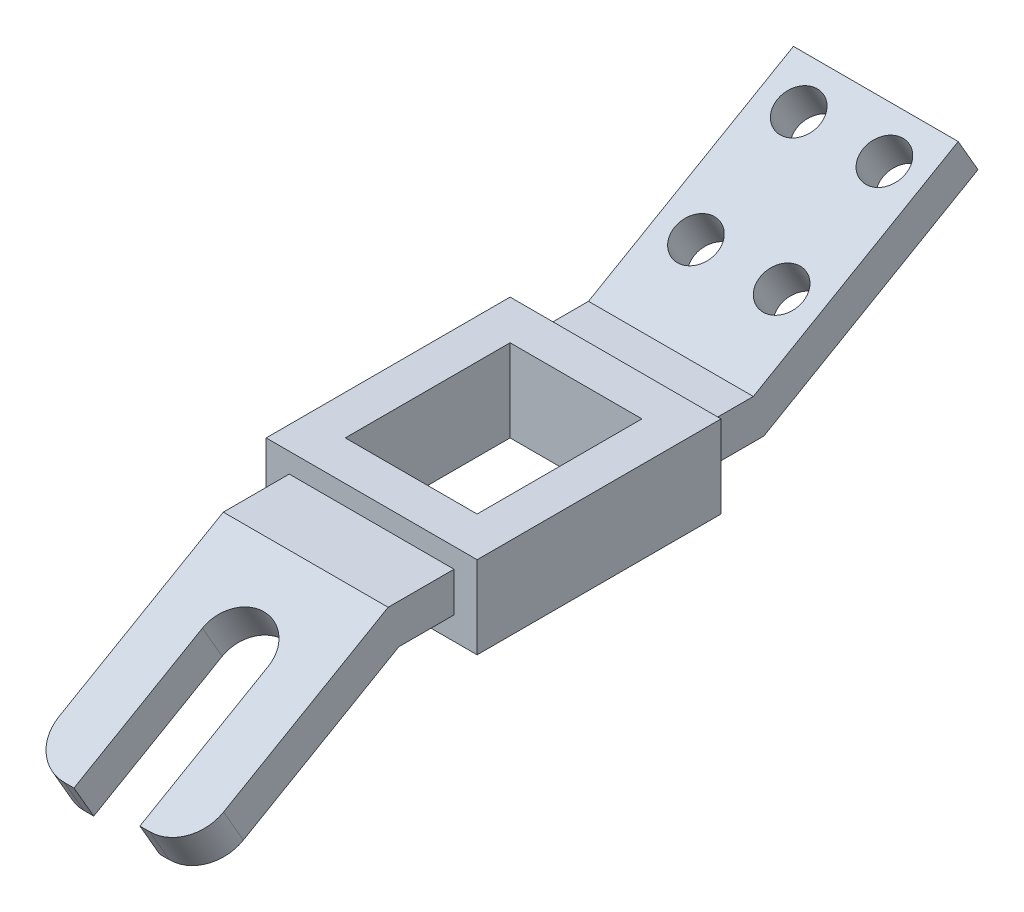
from build123d import *

# Parameters (mm, degrees)
CROQUIS1_W              = 64
CROQUIS1_H              = 74
CROQUIS1_W_2            = 40
CROQUIS1_H_2            = 50
SALIENTE_EXTRUIR2_DEPTH = 25
SALIENTE_EXTRUIR3_DEPTH = 25
CORTAR_EXTRUIR1_REACH   = 143.863
CROQUIS3_R              = 6.5
REDONDEO1_R             = 12
REDONDEO2_R             = 12
CORTAR_EXTRUIR2_REACH   = 163.641


with BuildPart() as part:
    # Croquis1 → Saliente-Extruir2 (new body)
    with BuildSketch(Plane(origin=(0, 0, 0), x_dir=(1, 0, 0), z_dir=(0, 1, 0))):
        Rectangle(CROQUIS1_W, CROQUIS1_H)
        Rectangle(CROQUIS1_W_2, CROQUIS1_H_2, mode=Mode.SUBTRACT)
    extrude(amount=SALIENTE_EXTRUIR2_DEPTH)

    # Croquis2 → Saliente-Extruir3 (add, symmetric)
    with BuildSketch(Plane(origin=(0, 0, 0), x_dir=(0, 0, -1), z_dir=(1, 0, 0))):
        Polygon((37, 19), (53.784609691, 19), (115.951905284, 54.892304845), (121.951905284, 44.5), (57, 7), (37, 7), align=None)
        Polygon((-37, 19), (-57, 19), (-117.312425174, -15.821394909), (-111.312425174, -26.213699755), (-53.784609691, 7), (-37, 7), align=None)
    extrude(amount=SALIENTE_EXTRUIR3_DEPTH, both=True)

    # Croquis3 → Cortar-Extruir1 (cut, up to next)
    with BuildSketch(Plane(origin=(0, -9.039419162, -5.218911087), x_dir=(1, 0, 0), z_dir=(0, 0.8660254037844378, 0.5000000000000016)), mode=Mode.PRIVATE) as cortar_extruir1_sk1:
        with Locations(Location((-13, 115.863448016, 0), (0, 0, 270))):
            Circle(CROQUIS3_R)
    cortar_extruir1_tool1 = extrude(cortar_extruir1_sk1.sketch, amount=-CORTAR_EXTRUIR1_REACH, mode=Mode.PRIVATE) & part.part
    # Croquis3 → Cortar-Extruir1 (cut, up to next)
    with BuildSketch(Plane(origin=(0, -9.039419162, -5.218911087), x_dir=(1, 0, 0), z_dir=(0, 0.8660254037844378, 0.5000000000000016)), mode=Mode.PRIVATE) as cortar_extruir1_sk2:
        with Locations(Location((13, 115.863448016, 0), (0, 0, 270))):
            Circle(CROQUIS3_R)
    cortar_extruir1_tool2 = extrude(cortar_extruir1_sk2.sketch, amount=-CORTAR_EXTRUIR1_REACH, mode=Mode.PRIVATE) & part.part
    # Croquis3 → Cortar-Extruir1 (cut, up to next)
    with BuildSketch(Plane(origin=(0, -9.039419162, -5.218911087), x_dir=(1, 0, 0), z_dir=(0, 0.8660254037844378, 0.5000000000000016)), mode=Mode.PRIVATE) as cortar_extruir1_sk3:
        with Locations(Location((-13, 79.863448016, 0), (0, 0, 270))):
            Circle(CROQUIS3_R)
    cortar_extruir1_tool3 = extrude(cortar_extruir1_sk3.sketch, amount=-CORTAR_EXTRUIR1_REACH, mode=Mode.PRIVATE) & part.part
    # Croquis3 → Cortar-Extruir1 (cut, up to next)
    with BuildSketch(Plane(origin=(0, -9.039419162, -5.218911087), x_dir=(1, 0, 0), z_dir=(0, 0.8660254037844378, 0.5000000000000016)), mode=Mode.PRIVATE) as cortar_extruir1_sk4:
        with Locations(Location((13, 79.863448016, 0), (0, 0, 270))):
            Circle(CROQUIS3_R)
    cortar_extruir1_tool4 = extrude(cortar_extruir1_sk4.sketch, amount=-CORTAR_EXTRUIR1_REACH, mode=Mode.PRIVATE) & part.part
    add(cortar_extruir1_tool1.solids().sort_by_distance((-13, 48.892305, -105.5596))[0], mode=Mode.SUBTRACT)
    add(cortar_extruir1_tool2.solids().sort_by_distance((13, 48.892305, -105.5596))[0], mode=Mode.SUBTRACT)
    add(cortar_extruir1_tool3.solids().sort_by_distance((-13, 30.892305, -74.382686))[0], mode=Mode.SUBTRACT)
    add(cortar_extruir1_tool4.solids().sort_by_distance((13, 30.892305, -74.382686))[0], mode=Mode.SUBTRACT)

    # Redondeo1
    redondeo1_edges = [part.edges().sort_by_distance(p)[0] for p in [
        (25, -21.017547332, 114.312425174),
    ]]
    fillet(redondeo1_edges, radius=REDONDEO1_R)

    # Redondeo2
    redondeo2_edges = [part.edges().sort_by_distance(p)[0] for p in [
        (-25, -21.017547332, 114.312425174),
    ]]
    fillet(redondeo2_edges, radius=REDONDEO2_R)

    # Croquis5 → Cortar-Extruir2 (cut, up to next)
    with BuildSketch(Plane(origin=(0, 38.931724008, 22.477241336), x_dir=(1, 0, 0), z_dir=(0, 0.8660254037844378, 0.5000000000000016)), mode=Mode.PRIVATE) as cortar_extruir2_sk1:
        with BuildLine():
            Line((-10, -64.506237835), (-10, -109.506237835))
            Line((-10, -109.506237835), (10, -109.506237835))
            Line((10, -109.506237835), (10, -64.506237835))
            ThreePointArc((10, -64.506237835), (0, -54.506237835), (-10, -64.506237835))
        make_face()
    cortar_extruir2_tool1 = extrude(cortar_extruir2_sk1.sketch, amount=-CORTAR_EXTRUIR2_REACH, mode=Mode.PRIVATE) & part.part
    add(cortar_extruir2_tool1.solids().sort_by_distance((0, -2.584336, 94.385167))[0], mode=Mode.SUBTRACT)


solid = part.part
